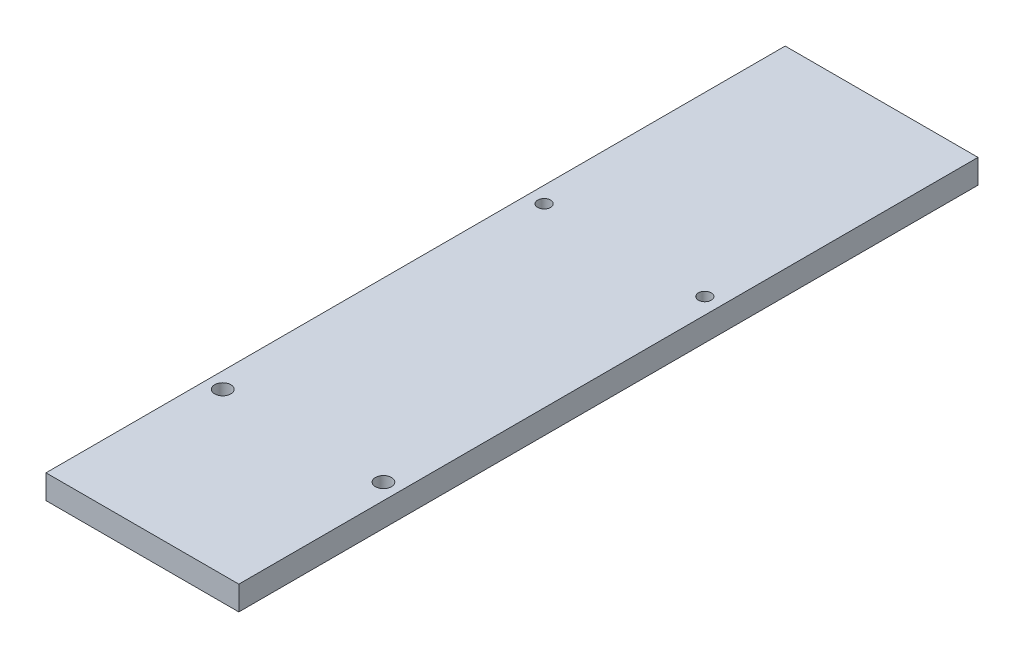
from build123d import *

# Parameters (mm, degrees)
SKETCH1_W           = 152.4
SKETCH1_H           = 584.2
BOSS_EXTRUDE1_DEPTH = 19.05
SKETCH2_R           = 5.08
SKETCH2_R_2         = 6.35
CUT_EXTRUDE1_DEPTH  = 605.051572715


with BuildPart() as part:
    # Sketch1 → Boss-Extrude1 (new body)
    with BuildSketch(Plane(origin=(0, 0, 0), x_dir=(1, 0, 0), z_dir=(0, 1, 0))):
        with Locations((76.2, 292.1)):
            Rectangle(SKETCH1_W, SKETCH1_H)
    extrude(amount=BOSS_EXTRUDE1_DEPTH)

    # Sketch2 → Cut-Extrude1 (cut, through all)
    with BuildSketch(Plane(origin=(0, 19.05, 0), x_dir=(1, 0, 0), z_dir=(0, 1, 0))):
        with Locations(Location((12.7, 381, 0), (0, 0, 270))):
            Circle(SKETCH2_R)
        with Locations(Location((139.7, 381, 0), (0, 0, 270))):
            Circle(SKETCH2_R)
        with Locations(Location((12.7, 127, 0), (0, 0, 270))):
            Circle(SKETCH2_R_2)
        with Locations(Location((139.7, 127, 0), (0, 0, 270))):
            Circle(SKETCH2_R_2)
    extrude(amount=-CUT_EXTRUDE1_DEPTH, mode=Mode.SUBTRACT)


solid = part.part
